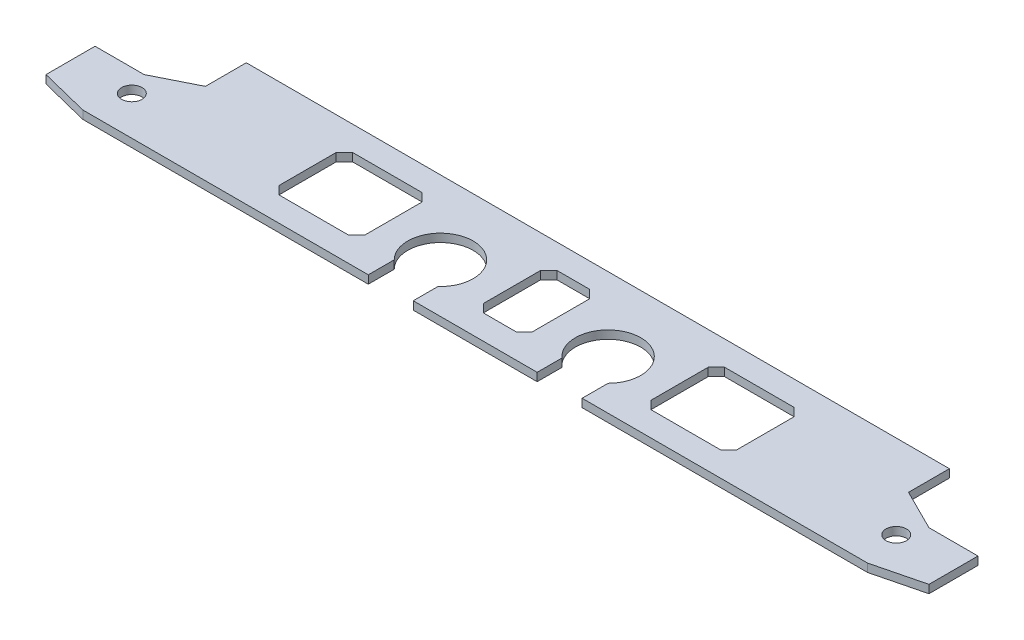
from build123d import *

# Parameters (mm, degrees)
CROQUIS1_W                = 86
CROQUIS1_H                = 15
SALIENTE_EXTRUIR1_DEPTH   = 1
CROQUIS2_W                = 6
CROQUIS2_H                = 9
CROQUIS2_W_2              = 10.5
CORTAR_EXTRUIR1_DEPTH     = 1
CHAFL_N1_SIZE             = 1
CORTAR_EXTRUIR2_DEPTH     = 1
CROQUIS4_R                = 1.25
SALIENTE_EXTRUIR2_DEPTH   = 1
SALIENTE_EXTRUIR2_2_DEPTH = 1


with BuildPart() as part:
    # Croquis1 → Saliente-Extruir1 (new body)
    with BuildSketch(Plane(origin=(0, 0, 0), x_dir=(1, 0, 0), z_dir=(0, 1, 0))):
        Rectangle(CROQUIS1_W, CROQUIS1_H)
    extrude(amount=SALIENTE_EXTRUIR1_DEPTH)

    # Croquis2 → Cortar-Extruir1 (cut)
    with BuildSketch(Plane(origin=(0, 1, 0), x_dir=(1, 0, 0), z_dir=(0, 1, 0))):
        Rectangle(CROQUIS2_W, CROQUIS2_H)
        with Locations((22.75, 0)):
            Rectangle(CROQUIS2_W_2, CROQUIS2_H)
        with Locations((-22.75, 0)):
            Rectangle(CROQUIS2_W_2, CROQUIS2_H)
    extrude(amount=-CORTAR_EXTRUIR1_DEPTH, mode=Mode.SUBTRACT)

    # Chaflán1
    chafl_n1_edges = [part.edges().sort_by_distance(p)[0] for p in [
        (17.5, 0.5, -4.5),
        (28, 0.5, -4.5),
        (3, 0.5, -4.5),
        (-3, 0.5, -4.5),
        (-3, 0.5, 4.5),
        (17.5, 0.5, 4.5),
        (28, 0.5, 4.5),
        (3, 0.5, 4.5),
        (-17.5, 0.5, 4.5),
        (-28, 0.5, 4.5),
        (-17.5, 0.5, -4.5),
        (-28, 0.5, -4.5),
    ]]
    chamfer(chafl_n1_edges, length=CHAFL_N1_SIZE)

    # Croquis3 → Cortar-Extruir2 (cut)
    with BuildSketch(Plane(origin=(0, 1, 0), x_dir=(1, 0, 0), z_dir=(0, 1, 0))):
        with BuildLine():
            Line((-13.078515717, -7.5), (-7.578515717, -7.5))
            Line((-7.578515717, -7.5), (-7.578515717, -4.477107947))
            ThreePointArc((-7.578515717, -4.477107947), (-10.141843619, 2.498537507), (-13.078515717, -4.32833853))
            Line((-13.078515717, -4.32833853), (-13.078515717, -7.5))
        make_face()
        with BuildLine():
            Line((7.578515717, -7.5), (7.578515717, -4.477107947))
            ThreePointArc((7.578515717, -4.477107947), (10.141843619, 2.498537507), (13.078515717, -4.32833853))
            Line((13.078515717, -4.32833853), (13.078515717, -7.5))
            Line((13.078515717, -7.5), (7.578515717, -7.5))
        make_face()
    extrude(amount=-CORTAR_EXTRUIR2_DEPTH, mode=Mode.SUBTRACT)


with BuildPart() as body_2:
    # Croquis4 → Saliente-Extruir2 (new body)
    with BuildSketch(Plane(origin=(0, 1, 0), x_dir=(1, 0, 0), z_dir=(0, 1, 0))):
        Polygon((43, 2.5), (48, 0), (54, 0), (54, -6), (48, -7.5), (43, -7.5), align=None)
        with Locations((46.75, -2.75)):
            Circle(CROQUIS4_R, mode=Mode.SUBTRACT)
    extrude(amount=-SALIENTE_EXTRUIR2_DEPTH)


with BuildPart() as body_3:
    # Croquis4 → Saliente-Extruir2 2 (new body)
    with BuildSketch(Plane(origin=(0, 1, 0), x_dir=(1, 0, 0), z_dir=(0, 1, 0))):
        Polygon((-43, 2.5), (-48, 0), (-54, 0), (-54, -6), (-48, -7.5), (-43, -7.5), align=None)
        with Locations((-46.75, -2.75)):
            Circle(CROQUIS4_R, mode=Mode.SUBTRACT)
    extrude(amount=-SALIENTE_EXTRUIR2_2_DEPTH)


with BuildPart() as part_1:
    add(part.part)

    # Combinar1: union body 2, body 3
    add(body_2.part)
    add(body_3.part)


solid = part_1.part
